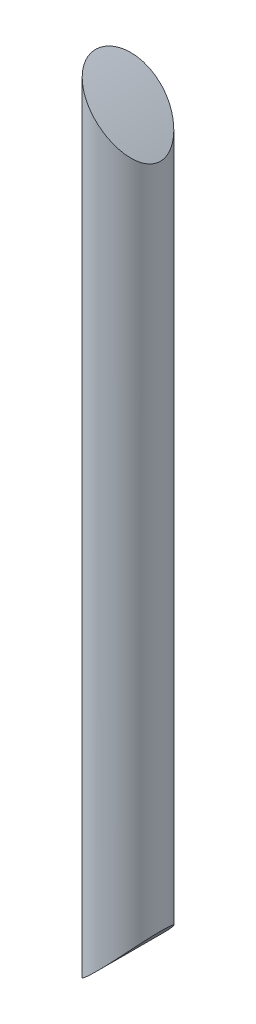
from build123d import *

# Parameters (mm, degrees)
SKETCH1_R               = 2
BOSS_EXTRUDE1_DEPTH     = 70
CUT_EXTRUDE1_DEPTH      = 71.057119553
CUT_EXTRUDE1_DEPTH_BACK = 71.057119553
SKETCH3_R               = 62.205590152
SKETCH3_R_2             = 32


with BuildPart() as part:
    # Sketch1 → Boss-Extrude1 (new body)
    with BuildSketch(Plane(origin=(0, 0, 0), x_dir=(1, 0, 0), z_dir=(0, 1, 0))):
        with Locations(Location((0, 0, 0), (0, 0, 270))):
            Circle(SKETCH1_R)
    extrude(amount=BOSS_EXTRUDE1_DEPTH)

    # Sketch3 → Cut-Extrude1 (cut, two sides: drawn at the far end of the back side and taken through both)
    with BuildSketch(Plane.XY.offset(-CUT_EXTRUDE1_DEPTH_BACK)):
        with Locations((-22.5, 35)):
            Circle(SKETCH3_R)
        with Locations((-22.5, 35)):
            Circle(SKETCH3_R_2, mode=Mode.SUBTRACT)
    extrude(amount=CUT_EXTRUDE1_DEPTH + CUT_EXTRUDE1_DEPTH_BACK, mode=Mode.SUBTRACT)


solid = part.part
